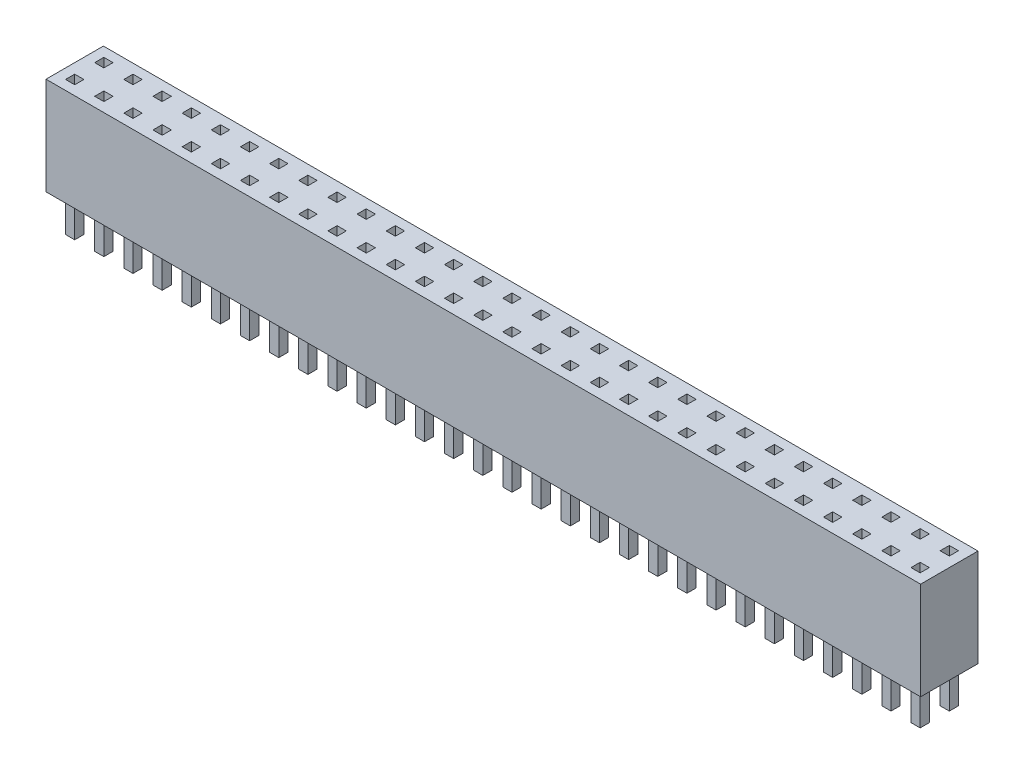
from build123d import *

# Parameters (mm, degrees)
SKETCH_1_W          = 76.2
SKETCH_1_H          = 5
EXTRUDE_1_DEPTH     = 8.5
SKETCH_3_W          = 0.8
SKETCH_3_H          = 0.8
CUT_EXTRUDE_1_DEPTH = 8
SKETCH_4_W          = 0.8
SKETCH_4_H          = 0.8
EXTRUDE_2_DEPTH     = 3.2


with BuildPart() as part:
    # 草图1 → 凸台-拉伸1 (new body)
    with BuildSketch(Plane(origin=(0, 0, 0), x_dir=(1, 0, 0), z_dir=(0, 1, 0))):
        with Locations((38.1, 2.5)):
            Rectangle(SKETCH_1_W, SKETCH_1_H)
    extrude(amount=EXTRUDE_1_DEPTH)

    # 草图3 → 切除-拉伸1 (cut)
    with BuildSketch(Plane(origin=(0, 8.5, 0), x_dir=(1, 0, 0), z_dir=(0, 1, 0))):
        with Locations((3.81, 3.77)):
            Rectangle(SKETCH_3_W, SKETCH_3_H)
        with Locations((1.27, 3.77)):
            Rectangle(SKETCH_3_W, SKETCH_3_H)
        with Locations((6.35, 3.77)):
            Rectangle(SKETCH_3_W, SKETCH_3_H)
        with Locations((8.89, 3.77)):
            Rectangle(SKETCH_3_W, SKETCH_3_H)
        with Locations((11.43, 3.77)):
            Rectangle(SKETCH_3_W, SKETCH_3_H)
        with Locations((13.97, 3.77)):
            Rectangle(SKETCH_3_W, SKETCH_3_H)
        with Locations((16.51, 3.77)):
            Rectangle(SKETCH_3_W, SKETCH_3_H)
        with Locations((19.05, 3.77)):
            Rectangle(SKETCH_3_W, SKETCH_3_H)
        with Locations((21.59, 3.77)):
            Rectangle(SKETCH_3_W, SKETCH_3_H)
        with Locations((24.13, 3.77)):
            Rectangle(SKETCH_3_W, SKETCH_3_H)
        with Locations((26.67, 3.77)):
            Rectangle(SKETCH_3_W, SKETCH_3_H)
        with Locations((29.21, 3.77)):
            Rectangle(SKETCH_3_W, SKETCH_3_H)
        with Locations((31.75, 3.77)):
            Rectangle(SKETCH_3_W, SKETCH_3_H)
        with Locations((34.29, 3.77)):
            Rectangle(SKETCH_3_W, SKETCH_3_H)
        with Locations((36.83, 3.77)):
            Rectangle(SKETCH_3_W, SKETCH_3_H)
        with Locations((39.37, 3.77)):
            Rectangle(SKETCH_3_W, SKETCH_3_H)
        with Locations((41.91, 3.77)):
            Rectangle(SKETCH_3_W, SKETCH_3_H)
        with Locations((44.45, 3.77)):
            Rectangle(SKETCH_3_W, SKETCH_3_H)
        with Locations((46.99, 3.77)):
            Rectangle(SKETCH_3_W, SKETCH_3_H)
        with Locations((49.53, 3.77)):
            Rectangle(SKETCH_3_W, SKETCH_3_H)
        with Locations((52.07, 3.77)):
            Rectangle(SKETCH_3_W, SKETCH_3_H)
        with Locations((54.61, 3.77)):
            Rectangle(SKETCH_3_W, SKETCH_3_H)
        with Locations((57.15, 3.77)):
            Rectangle(SKETCH_3_W, SKETCH_3_H)
        with Locations((59.69, 3.77)):
            Rectangle(SKETCH_3_W, SKETCH_3_H)
        with Locations((62.23, 3.77)):
            Rectangle(SKETCH_3_W, SKETCH_3_H)
        with Locations((64.77, 3.77)):
            Rectangle(SKETCH_3_W, SKETCH_3_H)
        with Locations((67.31, 3.77)):
            Rectangle(SKETCH_3_W, SKETCH_3_H)
        with Locations((69.85, 3.77)):
            Rectangle(SKETCH_3_W, SKETCH_3_H)
        with Locations((72.39, 3.77)):
            Rectangle(SKETCH_3_W, SKETCH_3_H)
        with Locations((74.93, 3.77)):
            Rectangle(SKETCH_3_W, SKETCH_3_H)
        with Locations((3.81, 1.23)):
            Rectangle(SKETCH_3_W, SKETCH_3_H)
        with Locations((6.35, 1.23)):
            Rectangle(SKETCH_3_W, SKETCH_3_H)
        with Locations((8.89, 1.23)):
            Rectangle(SKETCH_3_W, SKETCH_3_H)
        with Locations((11.43, 1.23)):
            Rectangle(SKETCH_3_W, SKETCH_3_H)
        with Locations((13.97, 1.23)):
            Rectangle(SKETCH_3_W, SKETCH_3_H)
        with Locations((16.51, 1.23)):
            Rectangle(SKETCH_3_W, SKETCH_3_H)
        with Locations((19.05, 1.23)):
            Rectangle(SKETCH_3_W, SKETCH_3_H)
        with Locations((21.59, 1.23)):
            Rectangle(SKETCH_3_W, SKETCH_3_H)
        with Locations((24.13, 1.23)):
            Rectangle(SKETCH_3_W, SKETCH_3_H)
        with Locations((26.67, 1.23)):
            Rectangle(SKETCH_3_W, SKETCH_3_H)
        with Locations((29.21, 1.23)):
            Rectangle(SKETCH_3_W, SKETCH_3_H)
        with Locations((31.75, 1.23)):
            Rectangle(SKETCH_3_W, SKETCH_3_H)
        with Locations((34.29, 1.23)):
            Rectangle(SKETCH_3_W, SKETCH_3_H)
        with Locations((36.83, 1.23)):
            Rectangle(SKETCH_3_W, SKETCH_3_H)
        with Locations((39.37, 1.23)):
            Rectangle(SKETCH_3_W, SKETCH_3_H)
        with Locations((41.91, 1.23)):
            Rectangle(SKETCH_3_W, SKETCH_3_H)
        with Locations((44.45, 1.23)):
            Rectangle(SKETCH_3_W, SKETCH_3_H)
        with Locations((46.99, 1.23)):
            Rectangle(SKETCH_3_W, SKETCH_3_H)
        with Locations((49.53, 1.23)):
            Rectangle(SKETCH_3_W, SKETCH_3_H)
        with Locations((52.07, 1.23)):
            Rectangle(SKETCH_3_W, SKETCH_3_H)
        with Locations((54.61, 1.23)):
            Rectangle(SKETCH_3_W, SKETCH_3_H)
        with Locations((57.15, 1.23)):
            Rectangle(SKETCH_3_W, SKETCH_3_H)
        with Locations((59.69, 1.23)):
            Rectangle(SKETCH_3_W, SKETCH_3_H)
        with Locations((62.23, 1.23)):
            Rectangle(SKETCH_3_W, SKETCH_3_H)
        with Locations((64.77, 1.23)):
            Rectangle(SKETCH_3_W, SKETCH_3_H)
        with Locations((67.31, 1.23)):
            Rectangle(SKETCH_3_W, SKETCH_3_H)
        with Locations((69.85, 1.23)):
            Rectangle(SKETCH_3_W, SKETCH_3_H)
        with Locations((72.39, 1.23)):
            Rectangle(SKETCH_3_W, SKETCH_3_H)
        with Locations((74.93, 1.23)):
            Rectangle(SKETCH_3_W, SKETCH_3_H)
        with Locations((1.27, 1.23)):
            Rectangle(SKETCH_3_W, SKETCH_3_H)
    extrude(amount=-CUT_EXTRUDE_1_DEPTH, mode=Mode.SUBTRACT)

    # 草图4 → 凸台-拉伸2 (add)
    with BuildSketch(Plane.XZ):
        with Locations((3.81, -3.77)):
            Rectangle(SKETCH_4_W, SKETCH_4_H)
        with Locations((1.27, -1.23)):
            Rectangle(SKETCH_4_W, SKETCH_4_H)
        with Locations((1.27, -3.77)):
            Rectangle(SKETCH_4_W, SKETCH_4_H)
        with Locations((3.81, -1.23)):
            Rectangle(SKETCH_4_W, SKETCH_4_H)
        with Locations((6.35, -3.77)):
            Rectangle(SKETCH_4_W, SKETCH_4_H)
        with Locations((6.35, -1.23)):
            Rectangle(SKETCH_4_W, SKETCH_4_H)
        with Locations((8.89, -3.77)):
            Rectangle(SKETCH_4_W, SKETCH_4_H)
        with Locations((8.89, -1.23)):
            Rectangle(SKETCH_4_W, SKETCH_4_H)
        with Locations((11.43, -3.77)):
            Rectangle(SKETCH_4_W, SKETCH_4_H)
        with Locations((11.43, -1.23)):
            Rectangle(SKETCH_4_W, SKETCH_4_H)
        with Locations((13.97, -3.77)):
            Rectangle(SKETCH_4_W, SKETCH_4_H)
        with Locations((13.97, -1.23)):
            Rectangle(SKETCH_4_W, SKETCH_4_H)
        with Locations((16.51, -3.77)):
            Rectangle(SKETCH_4_W, SKETCH_4_H)
        with Locations((16.51, -1.23)):
            Rectangle(SKETCH_4_W, SKETCH_4_H)
        with Locations((19.05, -3.77)):
            Rectangle(SKETCH_4_W, SKETCH_4_H)
        with Locations((19.05, -1.23)):
            Rectangle(SKETCH_4_W, SKETCH_4_H)
        with Locations((21.59, -3.77)):
            Rectangle(SKETCH_4_W, SKETCH_4_H)
        with Locations((21.59, -1.23)):
            Rectangle(SKETCH_4_W, SKETCH_4_H)
        with Locations((24.13, -3.77)):
            Rectangle(SKETCH_4_W, SKETCH_4_H)
        with Locations((24.13, -1.23)):
            Rectangle(SKETCH_4_W, SKETCH_4_H)
        with Locations((26.67, -3.77)):
            Rectangle(SKETCH_4_W, SKETCH_4_H)
        with Locations((26.67, -1.23)):
            Rectangle(SKETCH_4_W, SKETCH_4_H)
        with Locations((29.21, -3.77)):
            Rectangle(SKETCH_4_W, SKETCH_4_H)
        with Locations((29.21, -1.23)):
            Rectangle(SKETCH_4_W, SKETCH_4_H)
        with Locations((31.75, -3.77)):
            Rectangle(SKETCH_4_W, SKETCH_4_H)
        with Locations((31.75, -1.23)):
            Rectangle(SKETCH_4_W, SKETCH_4_H)
        with Locations((34.29, -3.77)):
            Rectangle(SKETCH_4_W, SKETCH_4_H)
        with Locations((34.29, -1.23)):
            Rectangle(SKETCH_4_W, SKETCH_4_H)
        with Locations((36.83, -3.77)):
            Rectangle(SKETCH_4_W, SKETCH_4_H)
        with Locations((36.83, -1.23)):
            Rectangle(SKETCH_4_W, SKETCH_4_H)
        with Locations((39.37, -3.77)):
            Rectangle(SKETCH_4_W, SKETCH_4_H)
        with Locations((39.37, -1.23)):
            Rectangle(SKETCH_4_W, SKETCH_4_H)
        with Locations((41.91, -3.77)):
            Rectangle(SKETCH_4_W, SKETCH_4_H)
        with Locations((41.91, -1.23)):
            Rectangle(SKETCH_4_W, SKETCH_4_H)
        with Locations((44.45, -3.77)):
            Rectangle(SKETCH_4_W, SKETCH_4_H)
        with Locations((44.45, -1.23)):
            Rectangle(SKETCH_4_W, SKETCH_4_H)
        with Locations((46.99, -3.77)):
            Rectangle(SKETCH_4_W, SKETCH_4_H)
        with Locations((46.99, -1.23)):
            Rectangle(SKETCH_4_W, SKETCH_4_H)
        with Locations((49.53, -3.77)):
            Rectangle(SKETCH_4_W, SKETCH_4_H)
        with Locations((49.53, -1.23)):
            Rectangle(SKETCH_4_W, SKETCH_4_H)
        with Locations((52.07, -3.77)):
            Rectangle(SKETCH_4_W, SKETCH_4_H)
        with Locations((52.07, -1.23)):
            Rectangle(SKETCH_4_W, SKETCH_4_H)
        with Locations((54.61, -3.77)):
            Rectangle(SKETCH_4_W, SKETCH_4_H)
        with Locations((54.61, -1.23)):
            Rectangle(SKETCH_4_W, SKETCH_4_H)
        with Locations((57.15, -3.77)):
            Rectangle(SKETCH_4_W, SKETCH_4_H)
        with Locations((57.15, -1.23)):
            Rectangle(SKETCH_4_W, SKETCH_4_H)
        with Locations((59.69, -3.77)):
            Rectangle(SKETCH_4_W, SKETCH_4_H)
        with Locations((59.69, -1.23)):
            Rectangle(SKETCH_4_W, SKETCH_4_H)
        with Locations((62.23, -3.77)):
            Rectangle(SKETCH_4_W, SKETCH_4_H)
        with Locations((62.23, -1.23)):
            Rectangle(SKETCH_4_W, SKETCH_4_H)
        with Locations((64.77, -3.77)):
            Rectangle(SKETCH_4_W, SKETCH_4_H)
        with Locations((64.77, -1.23)):
            Rectangle(SKETCH_4_W, SKETCH_4_H)
        with Locations((67.31, -3.77)):
            Rectangle(SKETCH_4_W, SKETCH_4_H)
        with Locations((67.31, -1.23)):
            Rectangle(SKETCH_4_W, SKETCH_4_H)
        with Locations((69.85, -3.77)):
            Rectangle(SKETCH_4_W, SKETCH_4_H)
        with Locations((69.85, -1.23)):
            Rectangle(SKETCH_4_W, SKETCH_4_H)
        with Locations((72.39, -3.77)):
            Rectangle(SKETCH_4_W, SKETCH_4_H)
        with Locations((72.39, -1.23)):
            Rectangle(SKETCH_4_W, SKETCH_4_H)
        with Locations((74.93, -3.77)):
            Rectangle(SKETCH_4_W, SKETCH_4_H)
        with Locations((74.93, -1.23)):
            Rectangle(SKETCH_4_W, SKETCH_4_H)
    extrude(amount=EXTRUDE_2_DEPTH)


solid = part.part
